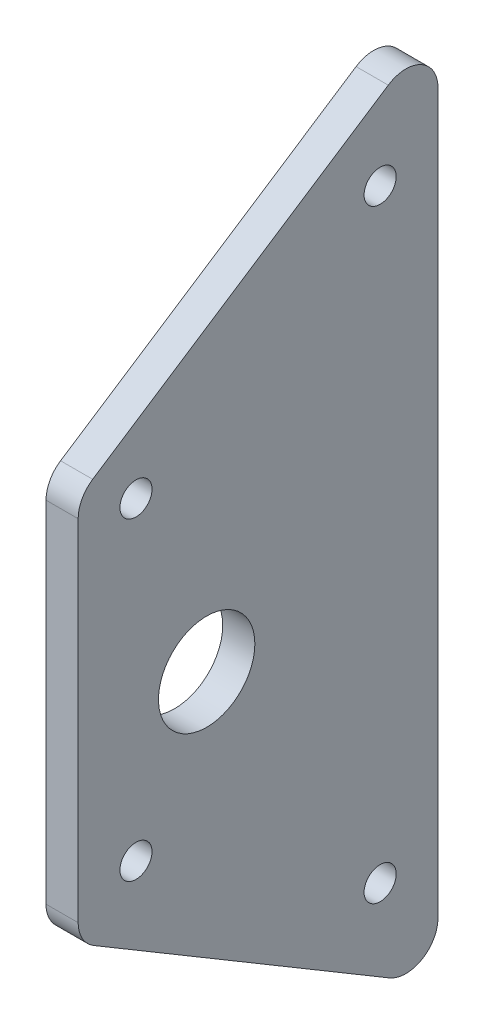
from build123d import *

# Parameters (mm, degrees)
SKETCH1_R           = 3.175
SKETCH1_R_2         = 9.525
BOSS_EXTRUDE1_DEPTH = 6.35
FILLET1_R           = 6.35
SKETCH3_R           = 6.35
SKETCH3_R_2         = 3.175
CUT_EXTRUDE1_DEPTH  = 1.27


with BuildPart() as part:
    # Sketch1 → Boss-Extrude1 (new body)
    with BuildSketch(Plane(origin=(0, 0, 0), x_dir=(0, 0, -1), z_dir=(1, 0, 0))):
        Polygon((-52.644692737, 31.005027933), (-52.644692737, -45.194972067), (18.475307263, -87.509385475), (18.475307263, 77.590614525), align=None)
        with Locations((7.045307263, 54.730614525)):
            Circle(SKETCH1_R, mode=Mode.SUBTRACT)
        with Locations((-41.214692737, 25.333347147)):
            Circle(SKETCH1_R, mode=Mode.SUBTRACT)
        with Locations((7.045307263, -64.649385475)):
            Circle(SKETCH1_R, mode=Mode.SUBTRACT)
        with Locations((-41.214692737, -36.709385475)):
            Circle(SKETCH1_R, mode=Mode.SUBTRACT)
        with Locations((-27.244692737, -11.309385475)):
            Circle(SKETCH1_R_2, mode=Mode.SUBTRACT)
    extrude(amount=BOSS_EXTRUDE1_DEPTH)

    # Fillet1
    fillet1_edges = [part.edges().sort_by_distance(p)[0] for p in [
        (3.175, 77.590614525, -18.475307263),
        (3.175, -87.509385475, -18.475307263),
        (3.175, -45.194972067, 52.644692737),
        (3.175, 31.005027933, 52.644692737),
    ]]
    fillet(fillet1_edges, radius=FILLET1_R)

    # Sketch3 → Cut-Extrude1 (cut)
    # profile 1 of 4: a face of its own
    with BuildSketch(Plane.ZY):
        with Locations((-7.045307263, 54.730614525)):
            Circle(SKETCH3_R)
        with Locations((-7.045307263, 54.730614525)):
            Circle(SKETCH3_R_2, mode=Mode.SUBTRACT)
    # profile 2 of 4: a face of its own
    with BuildSketch(Plane.ZY):
        with Locations((41.214692737, 25.333347147)):
            Circle(SKETCH3_R)
    # profile 3 of 4: a face of its own
    with BuildSketch(Plane.ZY):
        with Locations((41.214692737, -36.709385475)):
            Circle(SKETCH3_R)
    # profile 4 of 4: a face of its own
    with BuildSketch(Plane.ZY):
        with Locations((-7.045307263, -64.649385475)):
            Circle(SKETCH3_R)
    extrude(amount=-CUT_EXTRUDE1_DEPTH, mode=Mode.SUBTRACT)


solid = part.part
